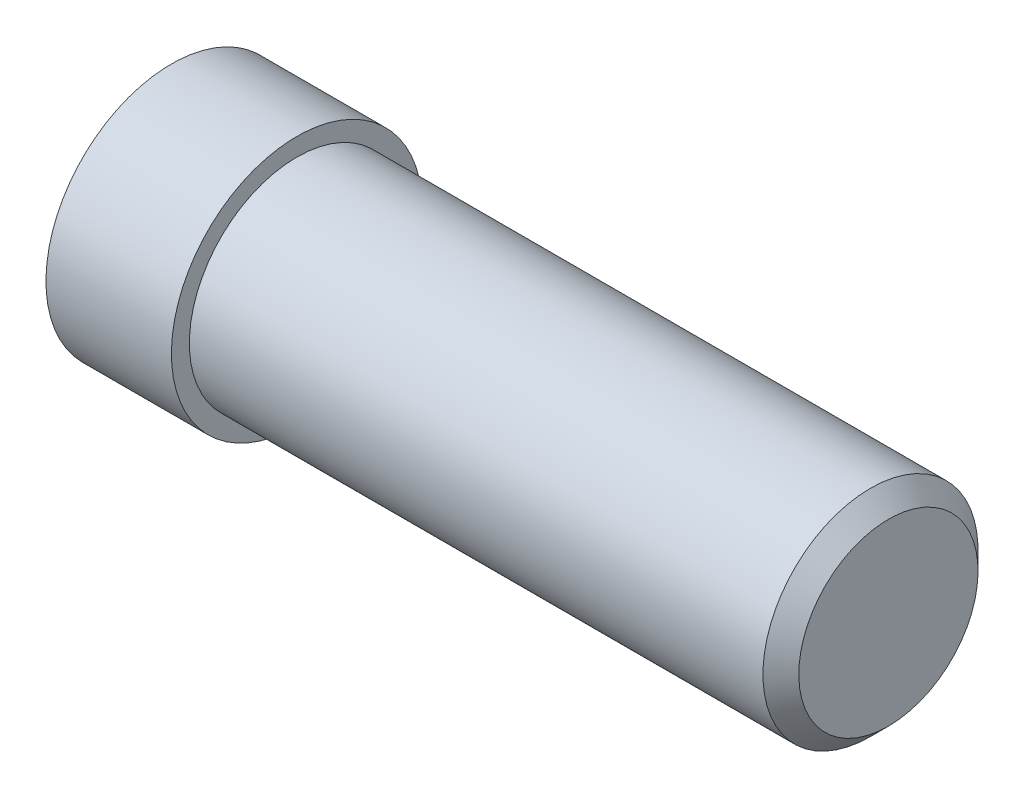
from build123d import *

# Parameters (mm, degrees)
PAH1_SIZE = 1


with BuildPart() as part:
    # Çizim1 → Döndür1 (revolve)
    with BuildSketch(Plane.XY, mode=Mode.PRIVATE) as d_nd_r1_sk:
        Polygon((0, 0), (0, 6), (-33, 6), (-33, 7), (-40, 7), (-40, 0), align=None)
    revolve(d_nd_r1_sk.sketch.rotate(Axis((-40, 0, 0), (1, 0, 0)), 180), axis=Axis((-40, 0, 0), (1, 0, 0)))

    # Pah1
    pah1_edges = [part.edges().sort_by_distance(p)[0] for p in [
        (0, 6, 0),
    ]]
    chamfer(pah1_edges, length=PAH1_SIZE)


solid = part.part
